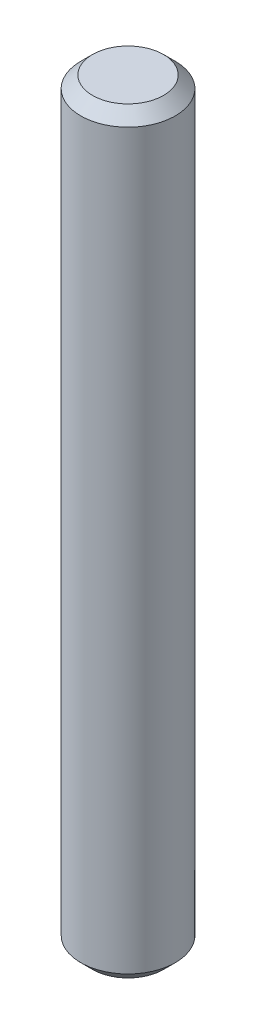
from build123d import *


with BuildPart() as part:
    # Sketch1 → Revolve1 (revolve)
    with BuildSketch(Plane.YZ, mode=Mode.PRIVATE) as revolve1_sk:
        Polygon((-12.7, 0), (12.7, 0), (12.7, 1.19126), (12.30376, 1.5875), (-12.30376, 1.5875), (-12.7, 1.19126), align=None)
    revolve(revolve1_sk.sketch.rotate(Axis((0, -12.7, 0), (0, 1, 0)), 180), axis=Axis((0, -12.7, 0), (0, 1, 0)))


solid = part.part
